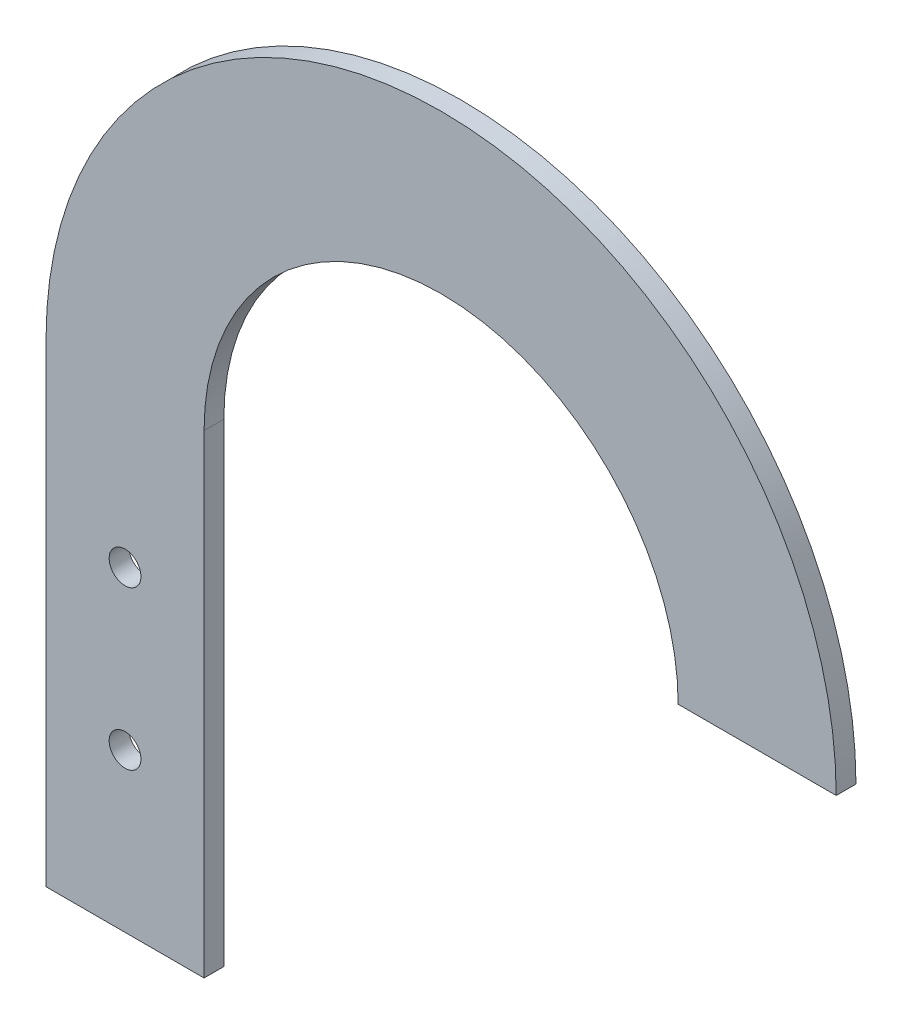
from build123d import *

# Parameters (mm, degrees)
BOSS_EXTRUDE1_DEPTH    = 3.175
F_10_CLEARANCE_HOLE1_D = 5.1054


with BuildPart() as part:
    # Sketch1 → Boss-Extrude1 (new body)
    with BuildSketch(Plane.XY):
        with BuildLine():
            Line((0, 0), (25.4, 0))
            Line((25.4, 0), (25.4, 76.2))
            ThreePointArc((25.4, 76.2), (63.5, 114.3), (101.6, 76.2))
            Line((101.6, 76.2), (127, 76.2))
            ThreePointArc((127, 76.2), (63.5, 139.7), (0, 76.2))
            Line((0, 76.2), (0, 0))
        make_face()
    extrude(amount=BOSS_EXTRUDE1_DEPTH)

    # #10 Clearance Hole1 (through all)
    with Locations(Plane(origin=(0, 0, 0), x_dir=(-1, 0, 0), z_dir=(0, 0, -1))):
        with Locations((-12.7, 25.4), (-12.7, 50.8)):
            Hole(F_10_CLEARANCE_HOLE1_D / 2)


solid = part.part
